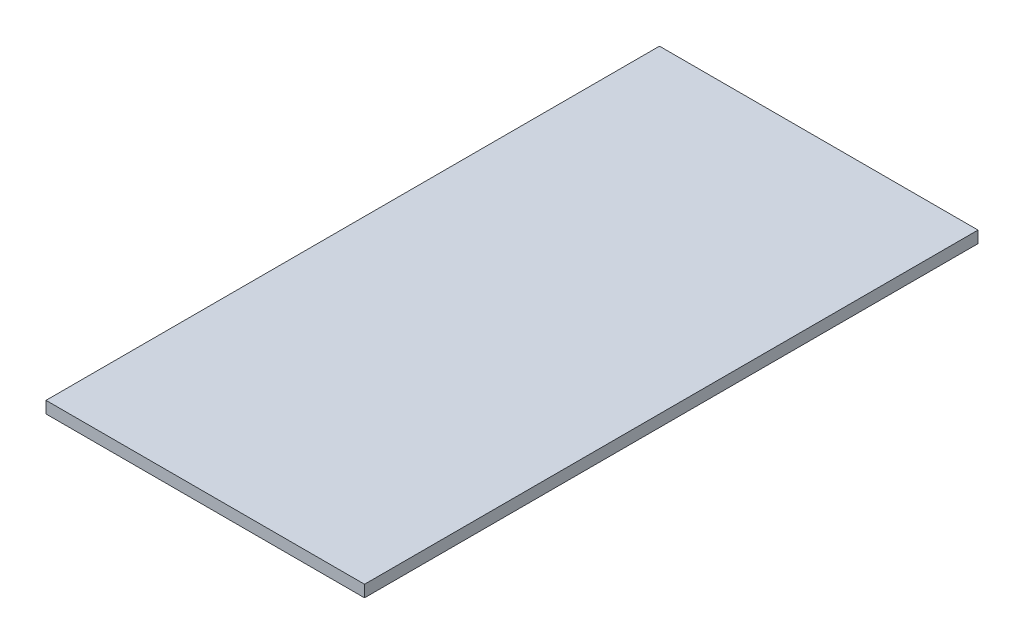
from build123d import *

# Parameters (mm, degrees)
SKETCH1_W           = 8229.6
SKETCH1_H           = 15849.6
BOSS_EXTRUDE1_DEPTH = 304.8


with BuildPart() as part:
    # Sketch1 → Boss-Extrude1 (new body)
    with BuildSketch(Plane(origin=(0, 0, 0), x_dir=(1, 0, 0), z_dir=(0, 1, 0))):
        Rectangle(SKETCH1_W, SKETCH1_H)
    extrude(amount=BOSS_EXTRUDE1_DEPTH)


solid = part.part
